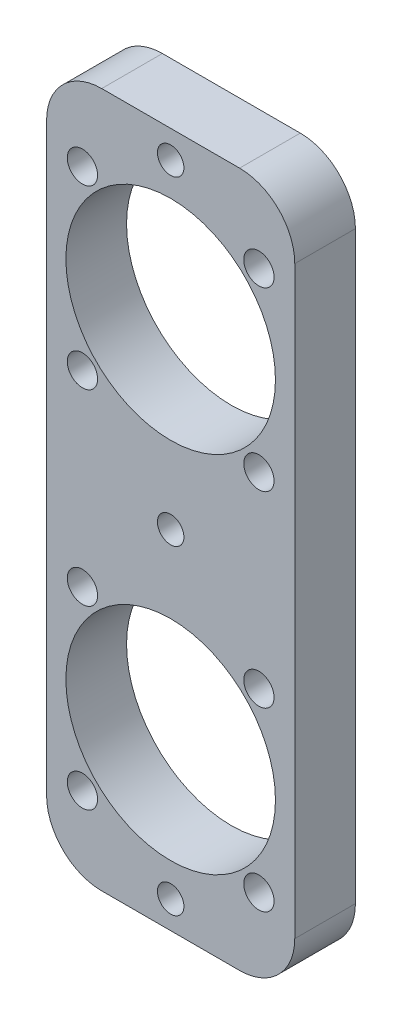
from build123d import *

# Parameters (mm, degrees)
SKETCH1_W            = 45
SKETCH1_H            = 60
BOSS_EXTRUDE1_DEPTH  = 11
SKETCH6_R            = 2.75
CUT_EXTRUDE2_DEPTH   = 8.5
CUT_EXTRUDE3_DEPTH   = 40.080046059
SKETCH11_W           = 45
SKETCH11_H           = 11
BOSS_EXTRUDE2_DEPTH  = 6
M4_CLEARANCE_HOLE2_D = 4.8
FILLET1_R            = 10


with BuildPart() as part:
    # Sketch1 → Boss-Extrude1 (new body)
    with BuildSketch(Plane.XY):
        Rectangle(SKETCH1_W, SKETCH1_H)
    boss_extrude1 = extrude(amount=-BOSS_EXTRUDE1_DEPTH)

    # Sketch6 → Cut-Extrude2 (cut)
    with BuildSketch(Plane.XY):
        with Locations((-16, 16)):
            Circle(SKETCH6_R)
        with Locations((16, 16)):
            Circle(SKETCH6_R)
        with Locations((16, -16)):
            Circle(SKETCH6_R)
        with Locations((-16, -16)):
            Circle(SKETCH6_R)
    cut_extrude2 = extrude(amount=-CUT_EXTRUDE2_DEPTH, mode=Mode.SUBTRACT)

    # Sketch7 → Cut-Extrude3 (cut, through all)
    with BuildSketch(Plane.XY):
        with BuildLine():
            ThreePointArc((19, 0), (0, 19), (-19, 0))
            ThreePointArc((-19, 0), (0, -19), (19, 0))
        make_face()
    cut_extrude3 = extrude(amount=-CUT_EXTRUDE3_DEPTH, mode=Mode.SUBTRACT)

    # Sketch11 → Boss-Extrude2 (add)
    with BuildSketch(Plane.XZ.offset(30)):
        with Locations((0, -5.5)):
            Rectangle(SKETCH11_W, SKETCH11_H)
    extrude(amount=BOSS_EXTRUDE2_DEPTH)

    # Mirror1: Boss-Extrude1, Cut-Extrude2, Cut-Extrude3 across plane
    add(boss_extrude1.mirror(Plane(origin=(0, -33, 0), x_dir=(0, 0, 1), z_dir=(0, -1, 0))))
    add(cut_extrude2.mirror(Plane(origin=(0, -33, 0), x_dir=(0, 0, 1), z_dir=(0, -1, 0))), mode=Mode.SUBTRACT)
    add(cut_extrude3.mirror(Plane(origin=(0, -33, 0), x_dir=(0, 0, 1), z_dir=(0, -1, 0))), mode=Mode.SUBTRACT)

    # M4 Clearance Hole2 (through all)
    with Locations(Plane.XY):
        with Locations((0, -91), (0, -33), (0, 25)):
            Hole(M4_CLEARANCE_HOLE2_D / 2)

    # Fillet1
    fillet1_edges = [part.edges().sort_by_distance(p)[0] for p in [
        (22.5, -96, -5.5),
        (-22.5, -96, -5.5),
        (-22.5, 30, -5.5),
        (22.5, 30, -5.5),
    ]]
    fillet(fillet1_edges, radius=FILLET1_R)


solid = part.part
